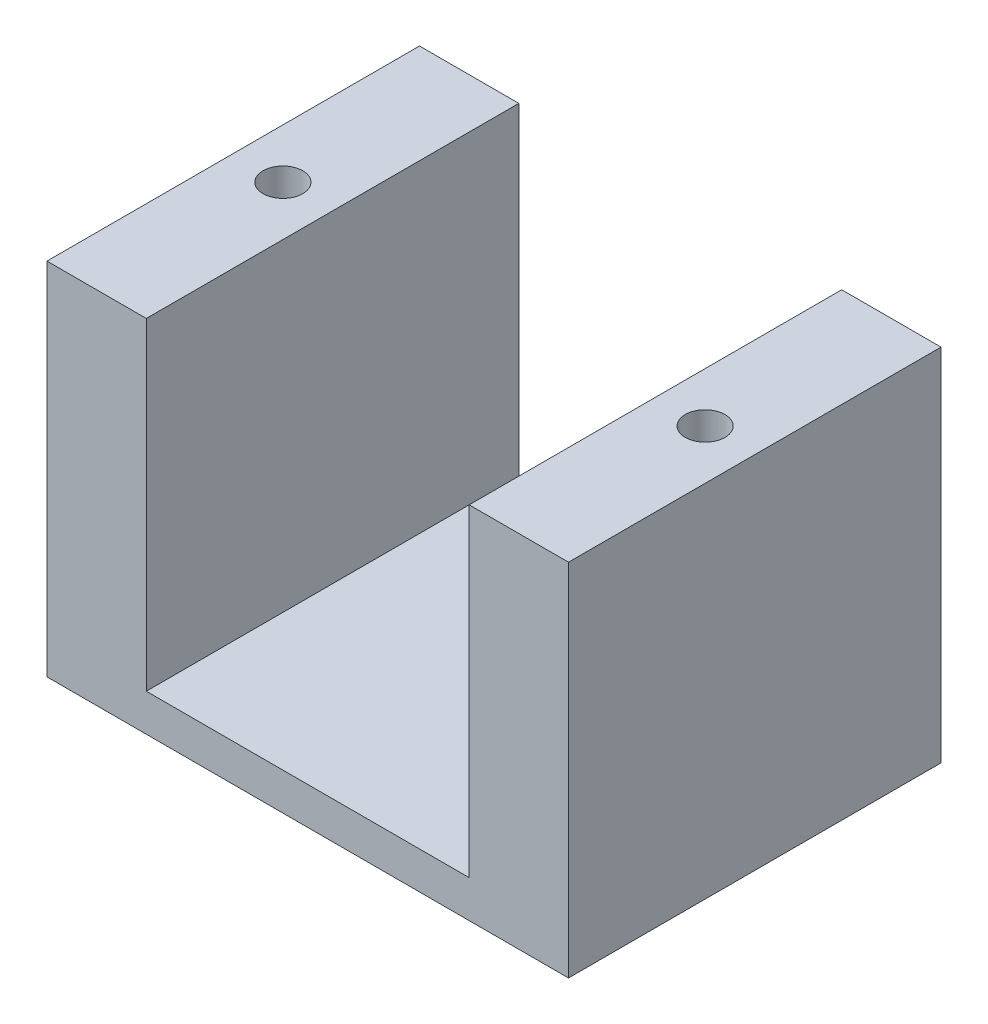
from build123d import *

# Parameters (mm, degrees)
SALIENTE_EXTRUIR1_DEPTH    = 30
CORTAR_EXTRUIR1_DEPTH      = 15
CORTAR_EXTRUIR1_DEPTH_BACK = 41
CROQUIS2_R                 = 1.6
CROQUIS3_R                 = 2.9
CORTAR_EXTRUIR2_DEPTH      = 3.2


with BuildPart() as part:
    # Croquis1 → Saliente-Extruir1 (new body)
    with BuildSketch(Plane.XY):
        Polygon((-21, 0), (-21, 29), (-13, 29), (-13, 3), (13, 3), (13, 29), (21, 29), (21, 0), align=None)
    extrude(amount=SALIENTE_EXTRUIR1_DEPTH)

    # Croquis2 → Cortar-Extruir1 (cut, two sides: drawn at the far end of the back side and taken through both)
    with BuildSketch(Plane.XZ.offset(-CORTAR_EXTRUIR1_DEPTH_BACK)):
        with Locations(Location((-17, 15, 0), (0, 0, 90))):
            Circle(CROQUIS2_R)
        with Locations(Location((17, 15, 0), (0, 0, 90))):
            Circle(CROQUIS2_R)
    extrude(amount=CORTAR_EXTRUIR1_DEPTH + CORTAR_EXTRUIR1_DEPTH_BACK, mode=Mode.SUBTRACT)

    # Croquis3 → Cortar-Extruir2 (cut)
    with BuildSketch(Plane.XZ):
        with Locations(Location((-17, 15, 0), (0, 0, 270))):
            Circle(CROQUIS3_R)
        with Locations(Location((17, 15, 0), (0, 0, 90))):
            Circle(CROQUIS3_R)
    extrude(amount=-CORTAR_EXTRUIR2_DEPTH, mode=Mode.SUBTRACT)


solid = part.part
